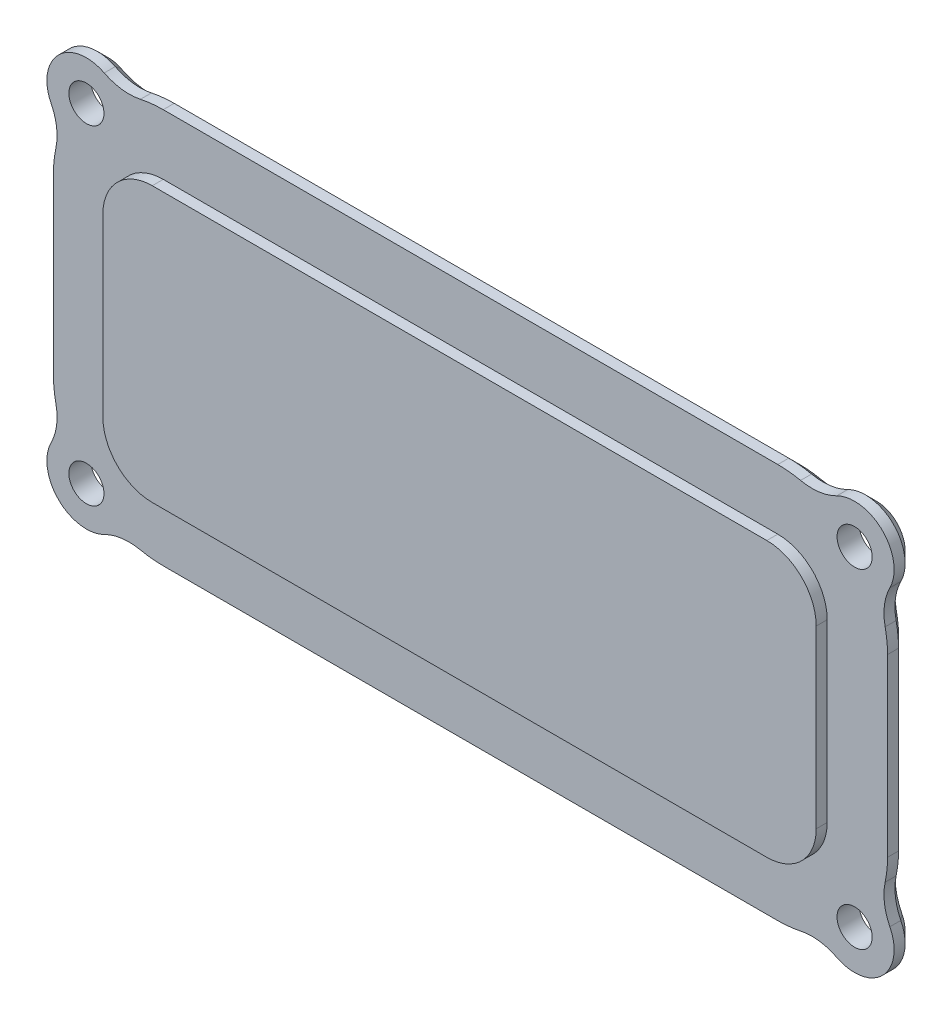
from build123d import *

# Parameters (mm, degrees)
SKETCH1_R           = 1.6
BOSS_EXTRUDE1_DEPTH = 2
BOSS_EXTRUDE2_DEPTH = 1
CHAMFER1_SIZE       = 1


with BuildPart() as part:
    # Sketch1 → Boss-Extrude1 (new body)
    with BuildSketch(Plane.XY):
        with BuildLine():
            Line((38, -8), (38, 8))
            ThreePointArc((38, 8), (37.945323743, 9.044287145), (37.781892872, 10.077154747))
            ThreePointArc((37.781892872, 10.077154747), (37.714830787, 11.762378479), (38.211886222, 13.374027399))
            ThreePointArc((38.211886222, 13.374027399), (37.545584412, 17.545584412), (33.374027399, 18.211886222))
            ThreePointArc((33.374027399, 18.211886222), (31.762378479, 17.714830787), (30.077154747, 17.781892872))
            ThreePointArc((30.077154747, 17.781892872), (29.044287145, 17.945323743), (28, 18))
            Line((28, 18), (-28, 18))
            ThreePointArc((-28, 18), (-29.044287145, 17.945323743), (-30.077154747, 17.781892872))
            ThreePointArc((-30.077154747, 17.781892872), (-31.762378479, 17.714830787), (-33.374027399, 18.211886222))
            ThreePointArc((-33.374027399, 18.211886222), (-37.545584412, 17.545584412), (-38.211886222, 13.374027399))
            ThreePointArc((-38.211886222, 13.374027399), (-37.714830787, 11.762378479), (-37.781892872, 10.077154747))
            ThreePointArc((-37.781892872, 10.077154747), (-37.945323743, 9.044287145), (-38, 8))
            Line((-38, 8), (-38, -8))
            ThreePointArc((-38, -8), (-37.945323743, -9.044287145), (-37.781892872, -10.077154747))
            ThreePointArc((-37.781892872, -10.077154747), (-37.714830787, -11.762378479), (-38.211886222, -13.374027399))
            ThreePointArc((-38.211886222, -13.374027399), (-37.545584412, -17.545584412), (-33.374027399, -18.211886222))
            ThreePointArc((-33.374027399, -18.211886222), (-31.762378479, -17.714830787), (-30.077154747, -17.781892872))
            ThreePointArc((-30.077154747, -17.781892872), (-29.044287145, -17.945323743), (-28, -18))
            Line((-28, -18), (28, -18))
            ThreePointArc((28, -18), (29.044287145, -17.945323743), (30.077154747, -17.781892872))
            ThreePointArc((30.077154747, -17.781892872), (31.762378479, -17.714830787), (33.374027399, -18.211886222))
            ThreePointArc((33.374027399, -18.211886222), (37.545584412, -17.545584412), (38.211886222, -13.374027399))
            ThreePointArc((38.211886222, -13.374027399), (37.714830787, -11.762378479), (37.781892872, -10.077154747))
            ThreePointArc((37.781892872, -10.077154747), (37.945323743, -9.044287145), (38, -8))
        make_face()
        with Locations((35, 15)):
            Circle(SKETCH1_R, mode=Mode.SUBTRACT)
        with Locations((-35, 15)):
            Circle(SKETCH1_R, mode=Mode.SUBTRACT)
        with Locations((35, -15)):
            Circle(SKETCH1_R, mode=Mode.SUBTRACT)
        with Locations((-35, -15)):
            Circle(SKETCH1_R, mode=Mode.SUBTRACT)
    extrude(amount=-BOSS_EXTRUDE1_DEPTH)

    # Sketch1<3> → Boss-Extrude2 (add)
    with BuildSketch(Plane.XY):
        with BuildLine():
            ThreePointArc((28, -12.5), (31.181980515, -11.181980515), (32.5, -8))
            Line((32.5, -8), (32.5, 8))
            ThreePointArc((32.5, 8), (31.181980515, 11.181980515), (28, 12.5))
            Line((28, 12.5), (-28, 12.5))
            ThreePointArc((-28, 12.5), (-31.181980515, 11.181980515), (-32.5, 8))
            Line((-32.5, 8), (-32.5, -8))
            ThreePointArc((-32.5, -8), (-31.181980515, -11.181980515), (-28, -12.5))
            Line((-28, -12.5), (28, -12.5))
        make_face()
    extrude(amount=BOSS_EXTRUDE2_DEPTH)

    # Chamfer1
    chamfer1_edges = [part.edges().sort_by_distance(p)[0] for p in [
        (-38, 0, -2),
        (-37.945323743, -9.044287145, -2),
        (-37.945323743, 9.044287145, -2),
        (-37.714830787, -11.762378479, -2),
        (-37.714830787, 11.762378479, -2),
        (-37.545584412, -17.545584412, -2),
        (-37.545584412, 17.545584412, -2),
        (-31.762378479, -17.714830787, -2),
        (-31.762378479, 17.714830787, -2),
        (-29.044287145, -17.945323743, -2),
        (-29.044287145, 17.945323743, -2),
        (0, -18, -2),
        (0, 18, -2),
        (29.044287145, -17.945323743, -2),
        (29.044287145, 17.945323743, -2),
        (31.762378479, -17.714830787, -2),
        (31.762378479, 17.714830787, -2),
        (37.545584412, -17.545584412, -2),
        (37.545584412, 17.545584412, -2),
        (37.714830787, -11.762378479, -2),
        (37.714830787, 11.762378479, -2),
        (37.945323743, -9.044287145, -2),
        (37.945323743, 9.044287145, -2),
        (38, 0, -2),
    ]]
    chamfer(chamfer1_edges, length=CHAMFER1_SIZE)


solid = part.part
